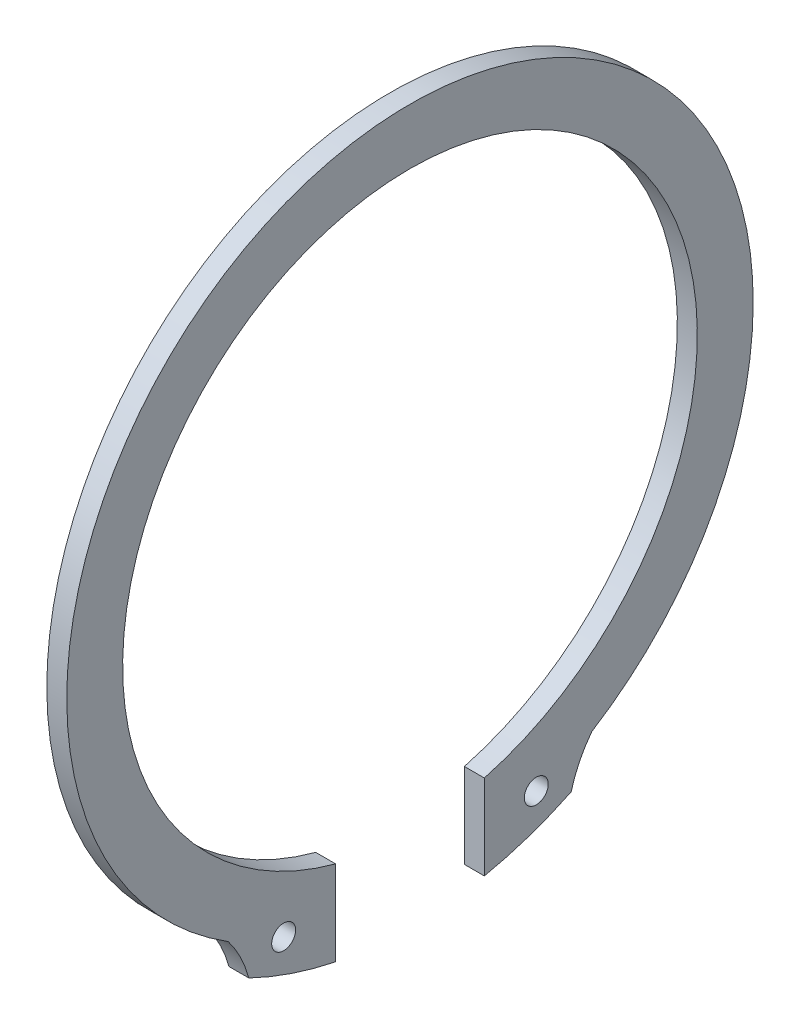
from build123d import *

# Parameters (mm, degrees)
ESQUISSE1_R        = 1.5
BOSS_EXTRU_1_DEPTH = 2.5


with BuildPart() as part:
    # Esquisse1 → Boss.-Extru.1 (new body)
    with BuildSketch(Plane(origin=(0, 0, 0), x_dir=(0, 0, -1), z_dir=(1, 0, 0))):
        with BuildLine():
            Line((-9.317485624, -34.773329746), (-9.317485624, -45.403821003))
            ThreePointArc((-9.317485624, -45.403821003), (-14.870482968, -43.89978629), (-20.194379814, -41.719414233))
            ThreePointArc((-20.194379814, -41.719414233), (-21.229656255, -38.966646831), (-22.782160988, -36.468796809))
            ThreePointArc((-22.782160988, -36.468796809), (0, 43), (22.782160988, -36.468796809))
            ThreePointArc((22.782160988, -36.468796809), (21.229656255, -38.966646831), (20.194379814, -41.719414233))
            ThreePointArc((20.194379814, -41.719414233), (14.870482968, -43.89978629), (9.317485624, -45.403821003))
            Line((9.317485624, -45.403821003), (9.317485624, -34.773329746))
            ThreePointArc((9.317485624, -34.773329746), (0, 36), (-9.317485624, -34.773329746))
        make_face()
        with Locations((-15.826054686, -39.441057647)):
            Circle(ESQUISSE1_R, mode=Mode.SUBTRACT)
        with Locations(Location((15.826054686, -39.441057647, 0), (0, 0, 180))):
            Circle(ESQUISSE1_R, mode=Mode.SUBTRACT)
    extrude(amount=BOSS_EXTRU_1_DEPTH)


solid = part.part
